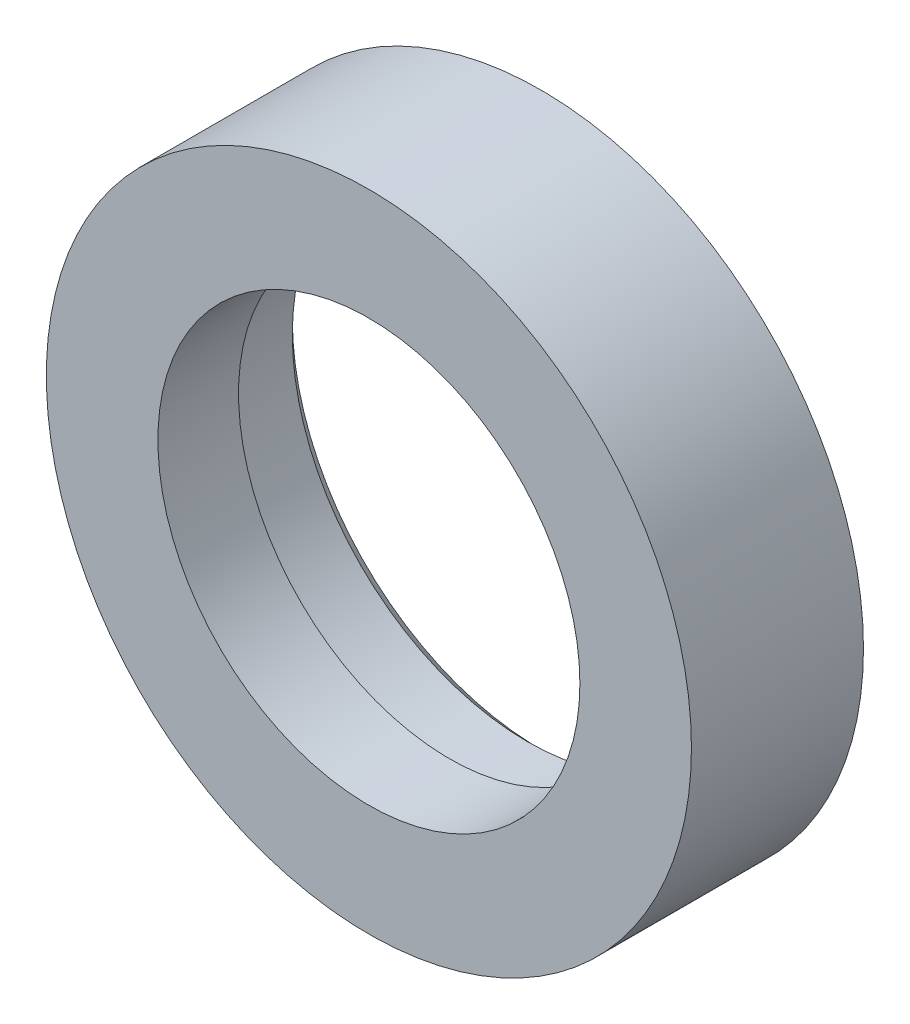
from build123d import *

# Parameters (mm, degrees)
CHANFREIN2_SIZE = 1


with BuildPart() as part:
    # Esquisse1 → Révolution1 (revolve)
    with BuildSketch(Plane(origin=(0, 0, 0), x_dir=(1, 0, 0), z_dir=(0, 1, 0))):
        Polygon((24, 5.665131579), (24, 18.465131579), (17.5, 18.465131579), (17.5, 11.665131579), (15.7, 11.665131579), (15.7, 5.665131579), align=None)
    revolve(axis=Axis((0, 0, 0), (0, 0, -1)))

    # Chanfrein2
    chanfrein2_edges = [part.edges().sort_by_distance(p)[0] for p in [
        (-17.5, 0, -18.465131579),
    ]]
    chamfer(chanfrein2_edges, length=CHANFREIN2_SIZE)


solid = part.part
